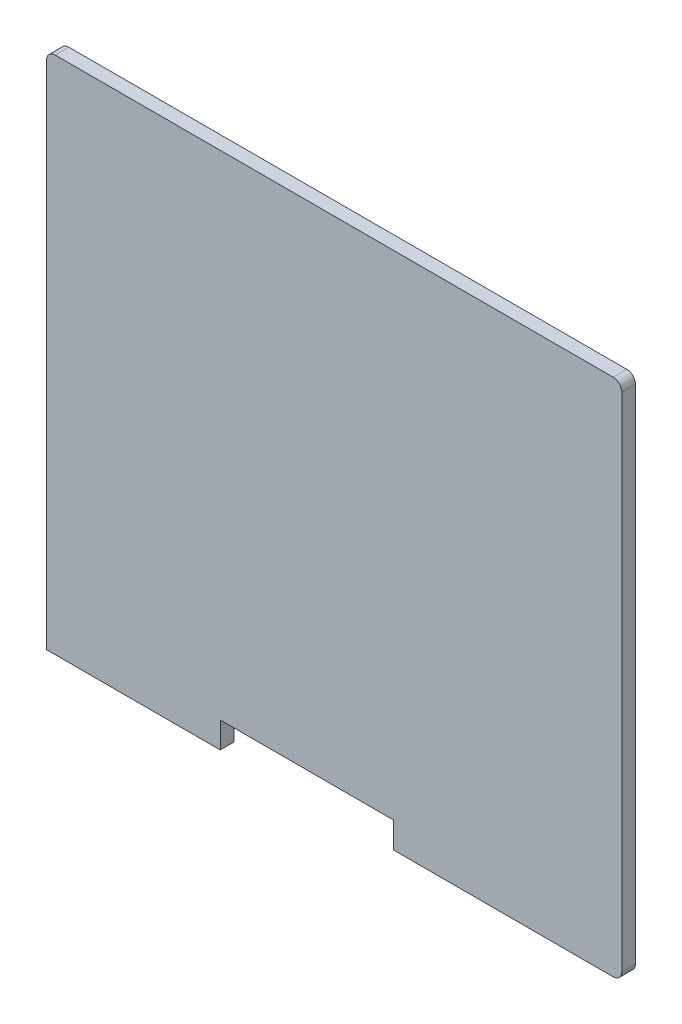
from build123d import *

# Parameters (mm, degrees)
BOSS_EXTRUDE1_DEPTH = 1.5748


with BuildPart() as part:
    # BPR2 PCB Outline → Boss-Extrude1 (new body)
    with BuildSketch(Plane.XY):
        with BuildLine():
            Line((75.642984325, 7.317563979), (75.642984325, 10.317563979))
            Line((75.642984325, 10.317563979), (95.642984325, 10.317563979))
            Line((95.642984325, 10.317563979), (95.642984325, 7.317563979))
            Line((95.642984325, 7.317563979), (121.040984325, 7.317563979))
            ThreePointArc((121.040984325, 7.317563979), (121.748091106, 7.610457198), (122.040984325, 8.317563979))
            Line((122.040984325, 8.317563979), (122.040984325, 66.317563979))
            ThreePointArc((122.040984325, 66.317563979), (121.748091106, 67.02467076), (121.040984325, 67.317563979))
            Line((121.040984325, 67.317563979), (56.570984325, 67.317563979))
            ThreePointArc((56.570984325, 67.317563979), (55.863877543, 67.02467076), (55.570984325, 66.317563979))
            Line((55.570984325, 66.317563979), (55.570984325, 7.317563979))
            Line((55.570984325, 7.317563979), (75.642984325, 7.317563979))
        make_face()
    extrude(amount=-BOSS_EXTRUDE1_DEPTH)


solid = part.part
